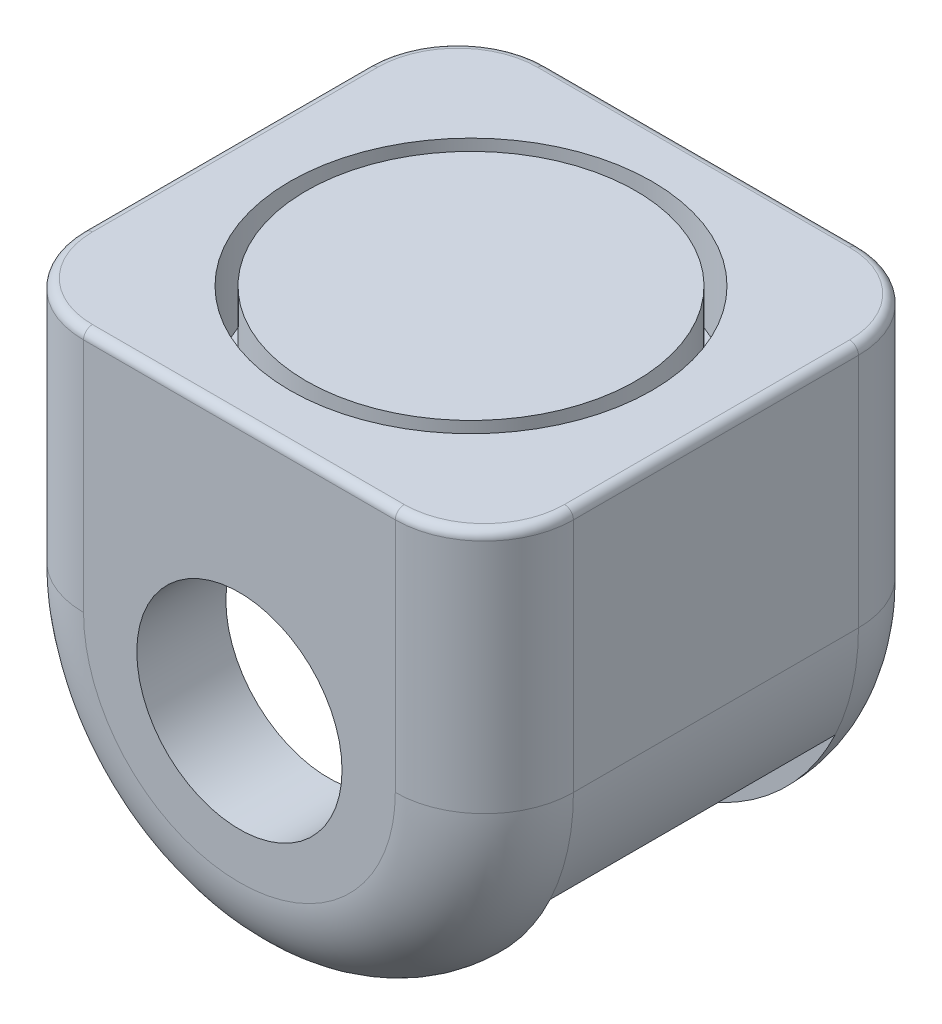
from build123d import *

# Parameters (mm, degrees)
BOSS_EXTRUDE1_DEPTH = 26
SKETCH3_R           = 20.325
SKETCH3_R_2         = 18.5
CUT_EXTRUDE1_DEPTH  = 10
FILLET1_R           = 10
FILLET5_R           = 1
CUT_EXTRUDE2_DEPTH  = 16
SKETCH10_R          = 11.52
CUT_EXTRUDE4_DEPTH  = 75


with BuildPart() as part:
    # Sketch2 → Boss-Extrude1 (new, symmetric)
    with BuildSketch(Plane.XY):
        with BuildLine():
            Line((-27.5, -27.5), (-27.5, 0))
            Line((-27.5, 0), (27.5, 0))
            Line((27.5, 0), (27.5, -27.5))
            ThreePointArc((27.5, -27.5), (0, -55), (-27.5, -27.5))
        make_face()
    extrude(amount=BOSS_EXTRUDE1_DEPTH, both=True)

    # Sketch3 → Cut-Extrude1 (cut)
    with BuildSketch(Plane(origin=(0, 0, 0), x_dir=(1, 0, 0), z_dir=(0, 1, 0))):
        with Locations(Location((0, 0, 0), (0, 0, 270))):
            Circle(SKETCH3_R)
        with Locations(Location((0, 0, 0), (0, 0, 270))):
            Circle(SKETCH3_R_2, mode=Mode.SUBTRACT)
    extrude(amount=-CUT_EXTRUDE1_DEPTH, mode=Mode.SUBTRACT)

    # Fillet1
    fillet1_edges = [part.edges().sort_by_distance(p)[0] for p in [
        (-27.5, -13.75, 26),
        (0, -55, 26),
        (-27.5, -13.75, -26),
        (27.5, -13.75, -26),
        (0, -55, -26),
        (27.5, -13.75, 26),
    ]]
    fillet(fillet1_edges, radius=FILLET1_R)

    # Fillet5
    fillet5_edges = [part.edges().sort_by_distance(p)[0] for p in [
        (27.5, 0, 0),
        (0, 0, -26),
        (-27.5, 0, 0),
        (0, 0, 26),
        (-24.571067812, 0, 23.071067812),
        (-24.571067812, 0, -23.071067812),
        (24.571067812, 0, 23.071067812),
        (24.571067812, 0, -23.071067812),
    ]]
    fillet(fillet5_edges, radius=FILLET5_R)

    # Sketch7 → Cut-Extrude2 (cut, symmetric)
    with BuildSketch(Plane.XY):
        with BuildLine():
            Line((-0.011296589, -11.876404256), (-25.011296589, -11.876404256))
            Line((-25.011296589, -11.876404256), (-25.011296589, -36.876404256))
            ThreePointArc((-25.011296589, -36.876404256), (-0.011296589, -61.876404256), (24.988703411, -36.876404256))
            Line((24.988703411, -36.876404256), (24.988703411, -11.876404256))
            Line((24.988703411, -11.876404256), (-0.011296589, -11.876404256))
        make_face()
    extrude(amount=CUT_EXTRUDE2_DEPTH, both=True, mode=Mode.SUBTRACT)

    # Sketch10 → Cut-Extrude4 (cut)
    with BuildSketch(Plane.XY.offset(26)):
        with Locations((0, -28.319318025)):
            Circle(SKETCH10_R)
    extrude(amount=-CUT_EXTRUDE4_DEPTH, mode=Mode.SUBTRACT)


solid = part.part
